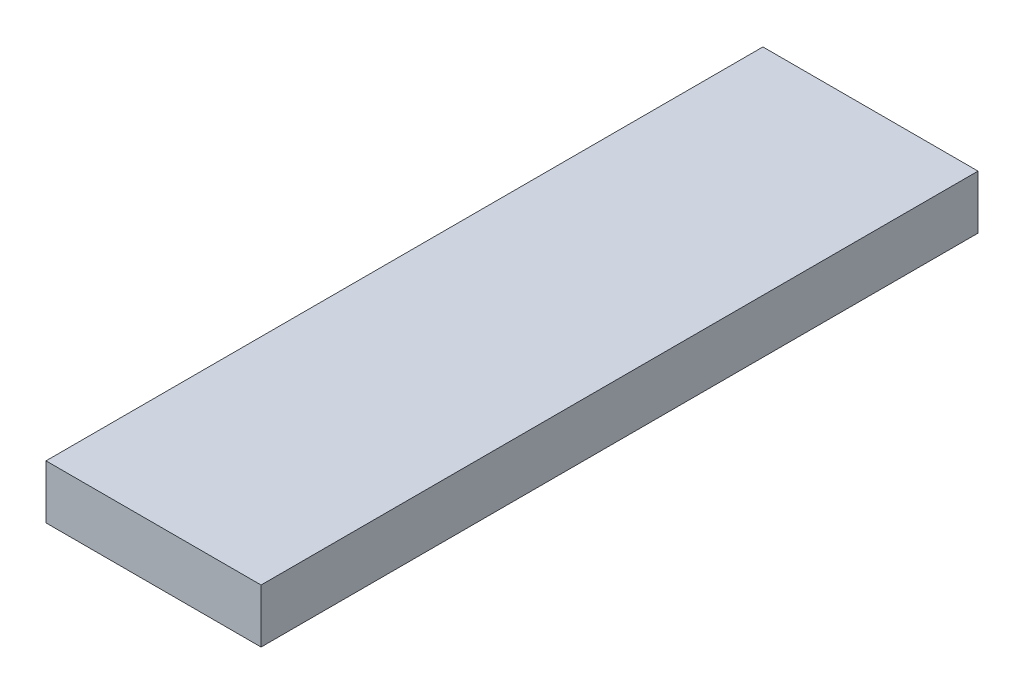
from build123d import *

# Parameters (mm, degrees)
SKETCH1_W           = 30
SKETCH1_H           = 100
BOSS_EXTRUDE1_DEPTH = 3.75
CUT_EXTRUDE1_START  = -3
SKETCH2_W           = 15
SKETCH2_H           = 50
CUT_EXTRUDE1_DEPTH  = 4


with BuildPart() as part:
    # Sketch1 → Boss-Extrude1 (new, symmetric)
    with BuildSketch(Plane(origin=(0, 0, 0), x_dir=(1, 0, 0), z_dir=(0, 1, 0))):
        with Locations((15, 0)):
            Rectangle(SKETCH1_W, SKETCH1_H)
    extrude(amount=BOSS_EXTRUDE1_DEPTH, both=True)

    # Sketch2 → Cut-Extrude1 (cut)
    with BuildSketch(Plane(origin=(0, 3.75, 0), x_dir=(1, 0, 0), z_dir=(0, 1, 0)).offset(CUT_EXTRUDE1_START)):
        with Locations((7.5, 0)):
            Rectangle(SKETCH2_W, SKETCH2_H)
    extrude(amount=-CUT_EXTRUDE1_DEPTH, mode=Mode.SUBTRACT)


solid = part.part
